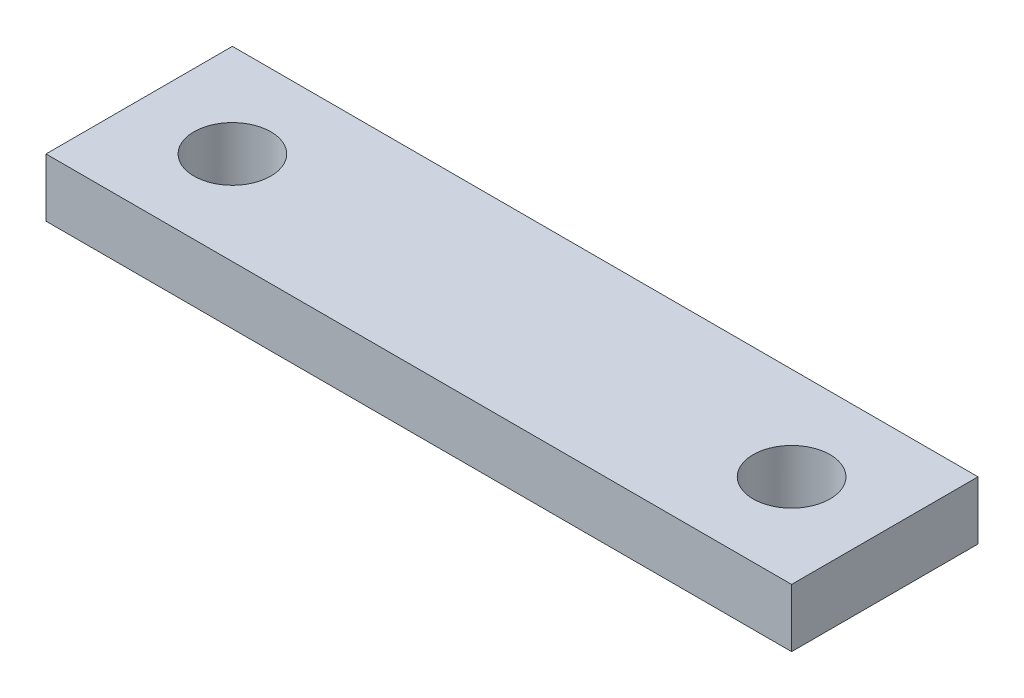
from build123d import *

# Parameters (mm, degrees)
SKETCH1_W           = 32
SKETCH1_H           = 8
BOSS_EXTRUDE1_DEPTH = 2.5
SKETCH2_R           = 1.65
CUT_EXTRUDE1_DEPTH  = 2.5


with BuildPart() as part:
    # Sketch1 → Boss-Extrude1 (new body)
    with BuildSketch(Plane(origin=(0, 0, 0), x_dir=(1, 0, 0), z_dir=(0, 1, 0))):
        with Locations((16, 4)):
            Rectangle(SKETCH1_W, SKETCH1_H)
    extrude(amount=BOSS_EXTRUDE1_DEPTH)

    # Sketch2 → Cut-Extrude1 (cut)
    with BuildSketch(Plane(origin=(0, 0, 0), x_dir=(1, 0, 0), z_dir=(0, 1, 0))):
        with Locations(Location((4, 4, 0), (0, 0, 90))):
            Circle(SKETCH2_R)
        with Locations(Location((28, 4, 0), (0, 0, 90))):
            Circle(SKETCH2_R)
    extrude(amount=CUT_EXTRUDE1_DEPTH, mode=Mode.SUBTRACT)


solid = part.part
